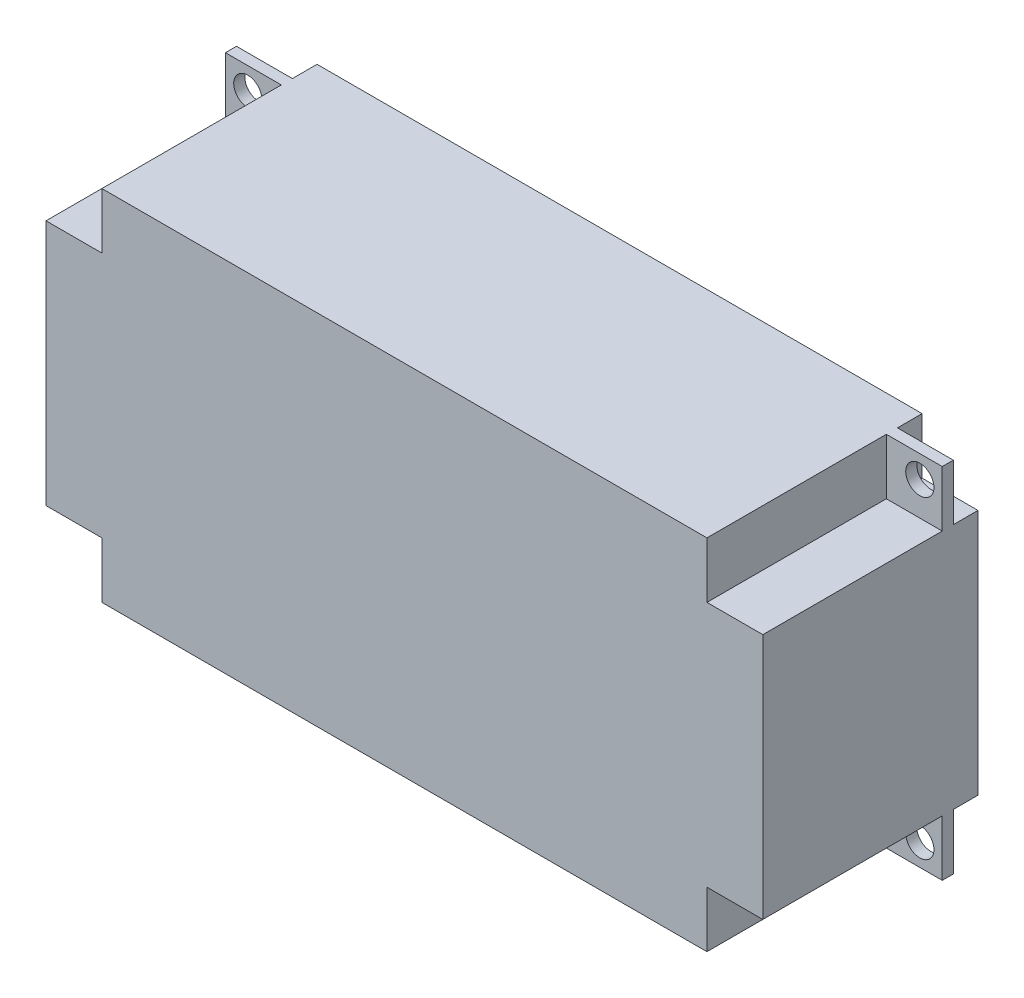
from build123d import *

# Parameters (mm, degrees)
SCHIZZO1_W                        = 101.6
SCHIZZO1_H                        = 50.8
ESTRUSIONE_ESTRUSIONE1_DEPTH      = 1.57
SCHIZZO2_R                        = 2
TAGLIO_ESTRUSIONE1_DEPTH          = 57.817822028
ESTRUSIONE_ESTRUSIONE2_DEPTH      = 25.43
ESTRUSIONE_ESTRUSIONE2_DEPTH_BACK = 5.07


with BuildPart() as part:
    # Schizzo1 → Estrusione-Estrusione1 (new body)
    with BuildSketch(Plane.XY):
        Rectangle(SCHIZZO1_W, SCHIZZO1_H)
    extrude(amount=ESTRUSIONE_ESTRUSIONE1_DEPTH)

    # Schizzo2 → Taglio-Estrusione1 (cut, through all)
    with BuildSketch(Plane.XY.offset(1.57)):
        with Locations((-47.625, 22.225)):
            Circle(SCHIZZO2_R)
        with Locations((47.625, 22.225)):
            Circle(SCHIZZO2_R)
        with Locations((47.625, -22.225)):
            Circle(SCHIZZO2_R)
        with Locations((-47.625, -22.225)):
            Circle(SCHIZZO2_R)
    extrude(amount=-TAGLIO_ESTRUSIONE1_DEPTH, mode=Mode.SUBTRACT)

    # Schizzo3 → Estrusione-Estrusione2 (add, two sides: drawn at the far end of the back side and taken through both)
    with BuildSketch(Plane.XY.offset(1.57).offset(-ESTRUSIONE_ESTRUSIONE2_DEPTH_BACK)):
        Polygon((-50.8, 17.48), (-42.88, 17.48), (-42.88, 25.4), (42.88, 25.4), (42.88, 17.48), (50.8, 17.48), (50.8, -17.48), (42.88, -17.48), (42.88, -25.4), (-42.88, -25.4), (-42.88, -17.48), (-50.8, -17.48), align=None)
    extrude(amount=ESTRUSIONE_ESTRUSIONE2_DEPTH + ESTRUSIONE_ESTRUSIONE2_DEPTH_BACK)


solid = part.part
